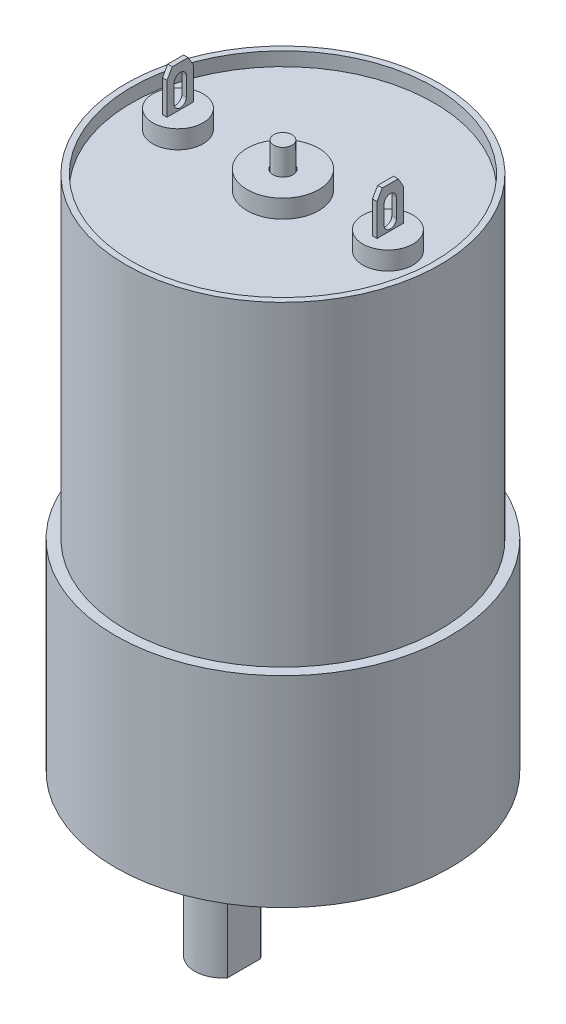
from build123d import *
from OCP.BRepFilletAPI import BRepFilletAPI_MakeChamfer

# Parameters (mm, degrees)
SCHIZZO1_R                   = 18.35
ESTRUSIONE_ESTRUSIONE1_DEPTH = 22
SCHIZZO2_R                   = 17.2
ESTRUSIONE_ESTRUSIONE2_DEPTH = 34.6
SCHIZZO3_R                   = 16.55
TAGLIO_ESTRUSIONE1_DEPTH     = 1.5
SCHIZZO4_R                   = 2.75
SCHIZZO4_R_2                 = 3.925
ESTRUSIONE_ESTRUSIONE3_DEPTH = 2
SCHIZZO5_W                   = 0.5
SCHIZZO5_H                   = 2.9
ESTRUSIONE_ESTRUSIONE4_DEPTH = 4.5
SMUSSO1_SIZE                 = 1
SMUSSO1_SIZE2                = 0.577350269
TAGLIO_ESTRUSIONE2_DEPTH     = 71.973886043
SCHIZZO7_R                   = 1.1
TAGLIO_ESTRUSIONE3_DEPTH     = 2
SCHIZZO8_R                   = 1
ESTRUSIONE_ESTRUSIONE5_DEPTH = 4.75
SCHIZZO9_R                   = 1.5
TAGLIO_ESTRUSIONE4_DEPTH     = 5
SCHIZZO10_R                  = 6
ESTRUSIONE_ESTRUSIONE6_DEPTH = 5.85
SCHIZZO11_R                  = 3
ESTRUSIONE_ESTRUSIONE7_DEPTH = 3
ESTRUSIONE_ESTRUSIONE8_DEPTH = 12


with BuildPart() as part:
    # Schizzo1 → Estrusione-Estrusione1 (new body)
    with BuildSketch(Plane(origin=(0, 0, 0), x_dir=(1, 0, 0), z_dir=(0, 1, 0))):
        with Locations(Location((0, 0, 0), (0, 0, 270))):
            Circle(SCHIZZO1_R)
    extrude(amount=ESTRUSIONE_ESTRUSIONE1_DEPTH)

    # Schizzo2 → Estrusione-Estrusione2 (add)
    with BuildSketch(Plane(origin=(0, 22, 0), x_dir=(1, 0, 0), z_dir=(0, 1, 0))):
        with Locations(Location((0, 0, 0), (0, 0, 270))):
            Circle(SCHIZZO2_R)
    extrude(amount=ESTRUSIONE_ESTRUSIONE2_DEPTH)

    # Schizzo3 → Taglio-Estrusione1 (cut)
    with BuildSketch(Plane(origin=(0, 56.6, 0), x_dir=(1, 0, 0), z_dir=(0, 1, 0))):
        with Locations(Location((0, 0, 0), (0, 0, 270))):
            Circle(SCHIZZO3_R)
    extrude(amount=-TAGLIO_ESTRUSIONE1_DEPTH, mode=Mode.SUBTRACT)

    # Schizzo4 → Estrusione-Estrusione3 (add)
    with BuildSketch(Plane(origin=(0, 55.1, 0), x_dir=(1, 0, 0), z_dir=(0, 1, 0))):
        with Locations(Location((11.5, 0, 0), (0, 0, 270))):
            Circle(SCHIZZO4_R)
        with Locations(Location((-11.5, 0, 0), (0, 0, 270))):
            Circle(SCHIZZO4_R)
        with Locations(Location((0, 0, 0), (0, 0, 270))):
            Circle(SCHIZZO4_R_2)
    extrude(amount=ESTRUSIONE_ESTRUSIONE3_DEPTH)

    # Schizzo5 → Estrusione-Estrusione4 (add)
    with BuildSketch(Plane(origin=(0, 57.1, 0), x_dir=(1, 0, 0), z_dir=(0, 1, 0))):
        with Locations((-11.5, 0)):
            Rectangle(SCHIZZO5_W, SCHIZZO5_H)
        with Locations((11.5, 0)):
            Rectangle(SCHIZZO5_W, SCHIZZO5_H)
    extrude(amount=ESTRUSIONE_ESTRUSIONE4_DEPTH)

    # Smusso1: one chamfer whose edges measure the first distance from different faces: ONE call of the kernel's chamfer builder (chamfer() names one face for all edges)
    smusso1_edges_1 = [part.edges().sort_by_distance(p)[0] for p in [
        (-11.5, 61.6, -1.45),
    ]]
    smusso1_side_1 = [part.faces().sort_by_distance(p)[0] for p in [
        (-11.5, 59.35, -1.45),
    ]]
    smusso1_edges_2 = [part.edges().sort_by_distance(p)[0] for p in [
        (-11.5, 61.6, 1.45),
    ]]
    smusso1_side_2 = [part.faces().sort_by_distance(p)[0] for p in [
        (-11.5, 59.35, 1.45),
    ]]
    smusso1_edges_3 = [part.edges().sort_by_distance(p)[0] for p in [
        (11.5, 61.6, -1.45),
    ]]
    smusso1_side_3 = [part.faces().sort_by_distance(p)[0] for p in [
        (11.5, 59.35, -1.45),
    ]]
    smusso1_edges_4 = [part.edges().sort_by_distance(p)[0] for p in [
        (11.5, 61.6, 1.45),
    ]]
    smusso1_side_4 = [part.faces().sort_by_distance(p)[0] for p in [
        (11.5, 59.35, 1.45),
    ]]
    smusso1 = BRepFilletAPI_MakeChamfer(part.part.solid().wrapped)
    for e in smusso1_edges_1:
        smusso1.Add(SMUSSO1_SIZE, SMUSSO1_SIZE2, e.wrapped, smusso1_side_1[0].wrapped)  # the first distance lies on this face
    for e in smusso1_edges_2:
        smusso1.Add(SMUSSO1_SIZE, SMUSSO1_SIZE2, e.wrapped, smusso1_side_2[0].wrapped)  # the first distance lies on this face
    for e in smusso1_edges_3:
        smusso1.Add(SMUSSO1_SIZE, SMUSSO1_SIZE2, e.wrapped, smusso1_side_3[0].wrapped)  # the first distance lies on this face
    for e in smusso1_edges_4:
        smusso1.Add(SMUSSO1_SIZE, SMUSSO1_SIZE2, e.wrapped, smusso1_side_4[0].wrapped)  # the first distance lies on this face
    add(Compound.cast(smusso1.Shape()), mode=Mode.REPLACE)

    # Schizzo6 → Taglio-Estrusione2 (cut, through all)
    with BuildSketch(Plane.ZY.offset(11.75)):
        with BuildLine():
            Line((0.675, 59.95), (0.675, 57.95))
            ThreePointArc((0.675, 57.95), (0, 57.275), (-0.675, 57.95))
            Line((-0.675, 57.95), (-0.675, 59.95))
            ThreePointArc((-0.675, 59.95), (0, 60.625), (0.675, 59.95))
        make_face()
    extrude(amount=-TAGLIO_ESTRUSIONE2_DEPTH, mode=Mode.SUBTRACT)

    # Schizzo7 → Taglio-Estrusione3 (cut)
    with BuildSketch(Plane(origin=(0, 57.1, 0), x_dir=(1, 0, 0), z_dir=(0, 1, 0))):
        with Locations(Location((0, 0, 0), (0, 0, 270))):
            Circle(SCHIZZO7_R)
    extrude(amount=-TAGLIO_ESTRUSIONE3_DEPTH, mode=Mode.SUBTRACT)

    # Schizzo8 → Estrusione-Estrusione5 (add)
    with BuildSketch(Plane(origin=(0, 55.1, 0), x_dir=(1, 0, 0), z_dir=(0, 1, 0))):
        with Locations(Location((0, 0, 0), (0, 0, 270))):
            Circle(SCHIZZO8_R)
    extrude(amount=ESTRUSIONE_ESTRUSIONE5_DEPTH)

    # Schizzo9 → Taglio-Estrusione4 (cut)
    with BuildSketch(Plane.XZ):
        with Locations(Location((0, -15.5, 0), (0, 0, 270))):
            Circle(SCHIZZO9_R)
        with Locations(Location((-13.423393759, -7.75, 0), (0, 0, 270))):
            Circle(SCHIZZO9_R)
        with Locations(Location((-13.423393759, 7.75, 0), (0, 0, 270))):
            Circle(SCHIZZO9_R)
        with Locations(Location((0, 15.5, 0), (0, 0, 270))):
            Circle(SCHIZZO9_R)
        with Locations(Location((13.423393759, 7.75, 0), (0, 0, 270))):
            Circle(SCHIZZO9_R)
        with Locations(Location((13.423393759, -7.75, 0), (0, 0, 270))):
            Circle(SCHIZZO9_R)
    extrude(amount=-TAGLIO_ESTRUSIONE4_DEPTH, mode=Mode.SUBTRACT)

    # Schizzo10 → Estrusione-Estrusione6 (add)
    with BuildSketch(Plane.XZ):
        with Locations(Location((-6.65, 0, 0), (0, 0, 270))):
            Circle(SCHIZZO10_R)
    extrude(amount=ESTRUSIONE_ESTRUSIONE6_DEPTH)

    # Schizzo11 → Estrusione-Estrusione7 (add)
    with BuildSketch(Plane.XZ.offset(5.85)):
        with Locations(Location((-6.65, 0, 0), (0, 0, 270))):
            Circle(SCHIZZO11_R)
    extrude(amount=ESTRUSIONE_ESTRUSIONE7_DEPTH)

    # Schizzo12 → Estrusione-Estrusione8 (add)
    with BuildSketch(Plane.XZ.offset(8.85)):
        with BuildLine():
            ThreePointArc((-9.65, 0), (-7.598683298, -2.846049894), (-4.25, -1.8))
            Line((-4.25, -1.8), (-4.25, 0))
            Line((-4.25, 0), (-9.65, 0))
        make_face()
        with BuildLine():
            Line((-9.65, 0), (-4.25, 0))
            Line((-4.25, 0), (-4.25, 1.8))
            ThreePointArc((-4.25, 1.8), (-7.598683298, 2.846049894), (-9.65, 0))
        make_face()
    extrude(amount=ESTRUSIONE_ESTRUSIONE8_DEPTH)


solid = part.part
